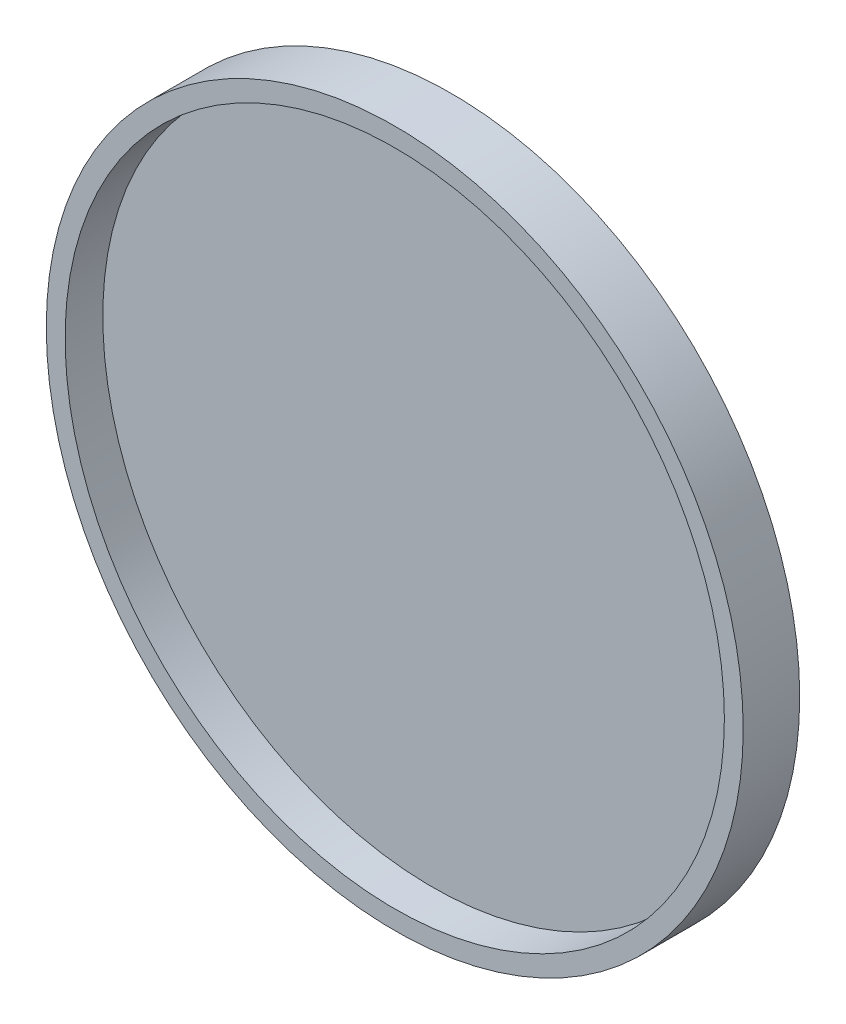
from build123d import *

# Parameters (mm, degrees)
ESQUISSE1_R             = 37
BOSS_EXTRU_1_DEPTH      = 6
ESQUISSE2_R             = 35
ENL_V_MAT_EXTRU_1_DEPTH = 4


with BuildPart() as part:
    # Esquisse1 → Boss.-Extru.1 (new body)
    with BuildSketch(Plane.XY):
        Circle(ESQUISSE1_R)
    extrude(amount=BOSS_EXTRU_1_DEPTH)

    # Esquisse2 → Enlèv. mat.-Extru.1 (cut)
    with BuildSketch(Plane.XY.offset(6)):
        Circle(ESQUISSE2_R)
    extrude(amount=-ENL_V_MAT_EXTRU_1_DEPTH, mode=Mode.SUBTRACT)


solid = part.part
